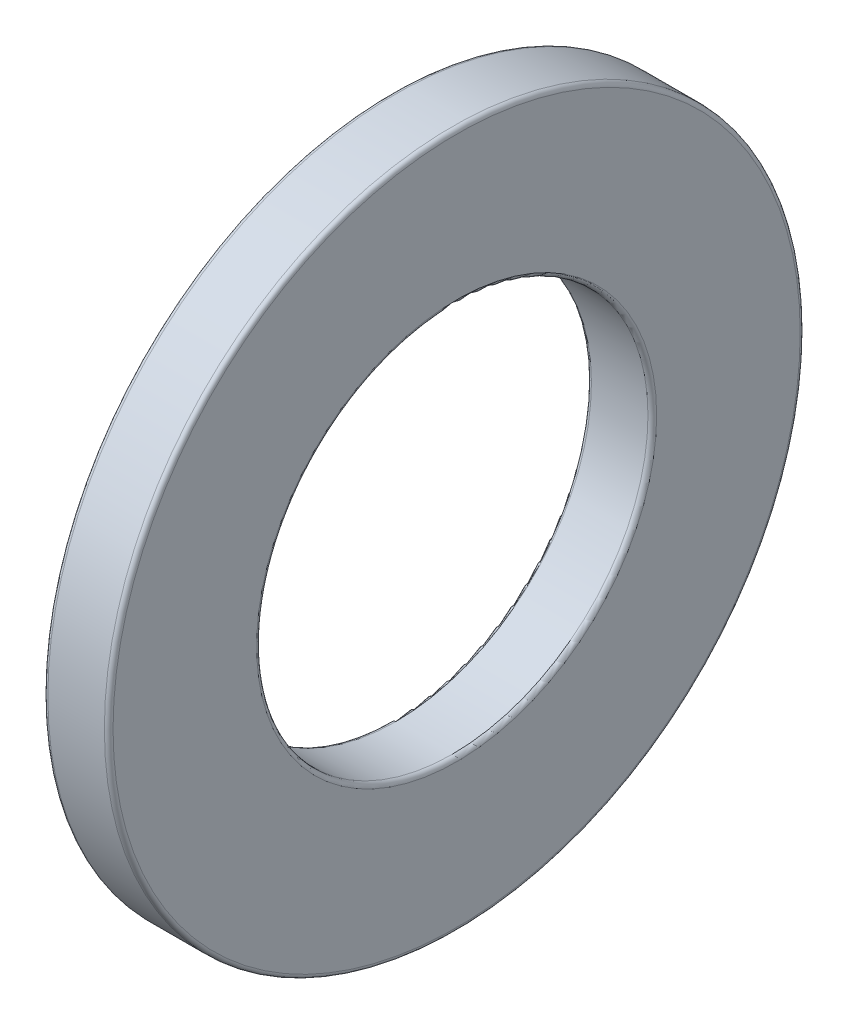
from build123d import *

# Parameters (mm, degrees)
SKETCH1_R           = 4
SKETCH1_R_2         = 2.25
BOSS_EXTRUDE1_DEPTH = 0.75
FILLET1_R           = 0.05


with BuildPart() as part:
    # Sketch1 → Boss-Extrude1 (new body)
    with BuildSketch(Plane(origin=(0, 0, 0), x_dir=(0, 0, -1), z_dir=(1, 0, 0))):
        Circle(SKETCH1_R)
        Circle(SKETCH1_R_2, mode=Mode.SUBTRACT)
    extrude(amount=BOSS_EXTRUDE1_DEPTH)

    # Fillet1
    fillet1_edges = [part.edges().sort_by_distance(p)[0] for p in [
        (0, 0, 4),
        (0.75, 0, 4),
        (0, 0, 2.25),
        (0.75, 0, 2.25),
    ]]
    fillet(fillet1_edges, radius=FILLET1_R)


solid = part.part
